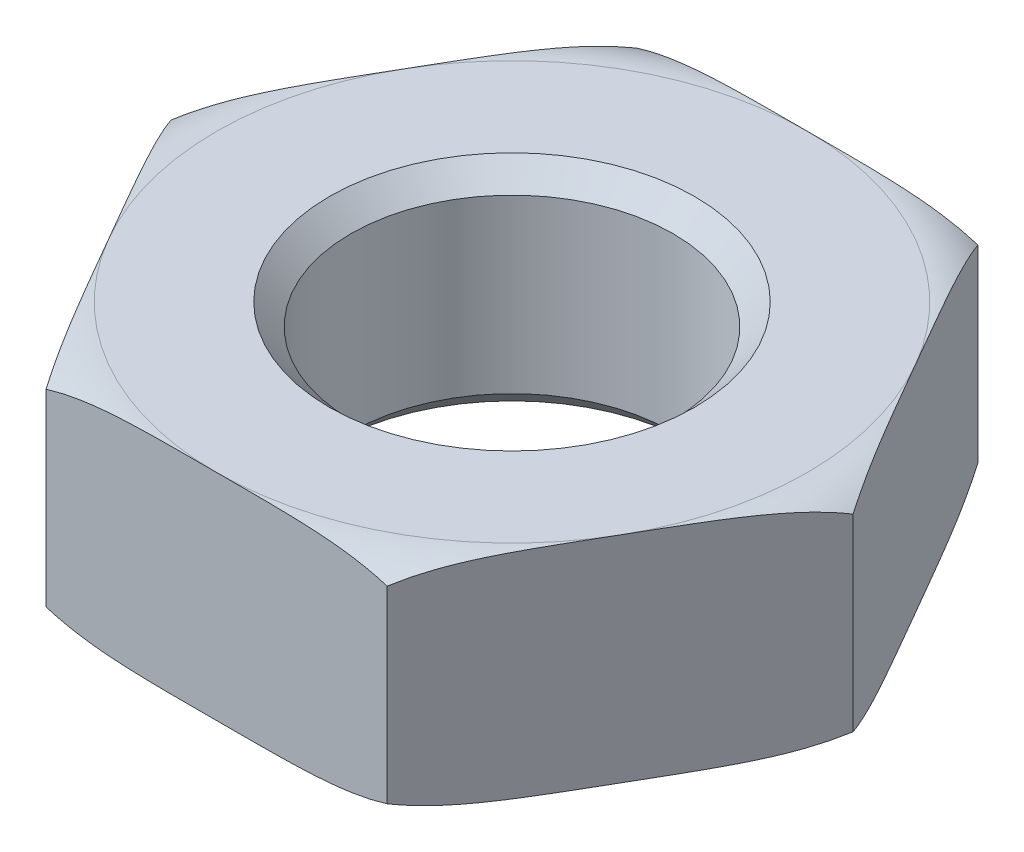
from build123d import *

# Parameters (mm, degrees)
SKETCH1_R           = 1.5
BOSS_EXTRUDE1_DEPTH = 1
CHAMFER1_SIZE       = 0.2


with BuildPart() as part:
    # Sketch1 → Boss-Extrude1 (new, symmetric)
    with BuildSketch(Plane(origin=(0, 0, 0), x_dir=(1, 0, 0), z_dir=(0, 1, 0))):
        Polygon((3.175426481, 0), (1.58771324, 2.75), (-1.58771324, 2.75), (-3.175426481, 0), (-1.58771324, -2.75), (1.58771324, -2.75), align=None)
        with Locations(Location((0, 0, 0), (0, 0, 270))):
            Circle(SKETCH1_R, mode=Mode.SUBTRACT)
    extrude(amount=BOSS_EXTRUDE1_DEPTH, both=True)

    # Sketch2 → Cut-Revolve1 (revolve, cut)
    with BuildSketch(Plane.XY):
        with BuildLine():
            Line((-3.55, -0.2), (-3.55, -1))
            Line((-3.55, -1), (-2.75, -1))
            ThreePointArc((-2.75, -1), (-3.315685425, -0.765685425), (-3.55, -0.2))
        make_face()
    cut_revolve1 = revolve(axis=Axis((0, 0, 0), (0, 1, 0)), mode=Mode.SUBTRACT)

    # Mirror2: Cut-Revolve1 across plane
    add(cut_revolve1.mirror(Plane.ZX), mode=Mode.SUBTRACT)

    # Chamfer1
    chamfer1_edges = [part.edges().sort_by_distance(p)[0] for p in [
        (0, -1, -1.5),
        (0, 1, -1.5),
    ]]
    chamfer(chamfer1_edges, length=CHAMFER1_SIZE)


solid = part.part
